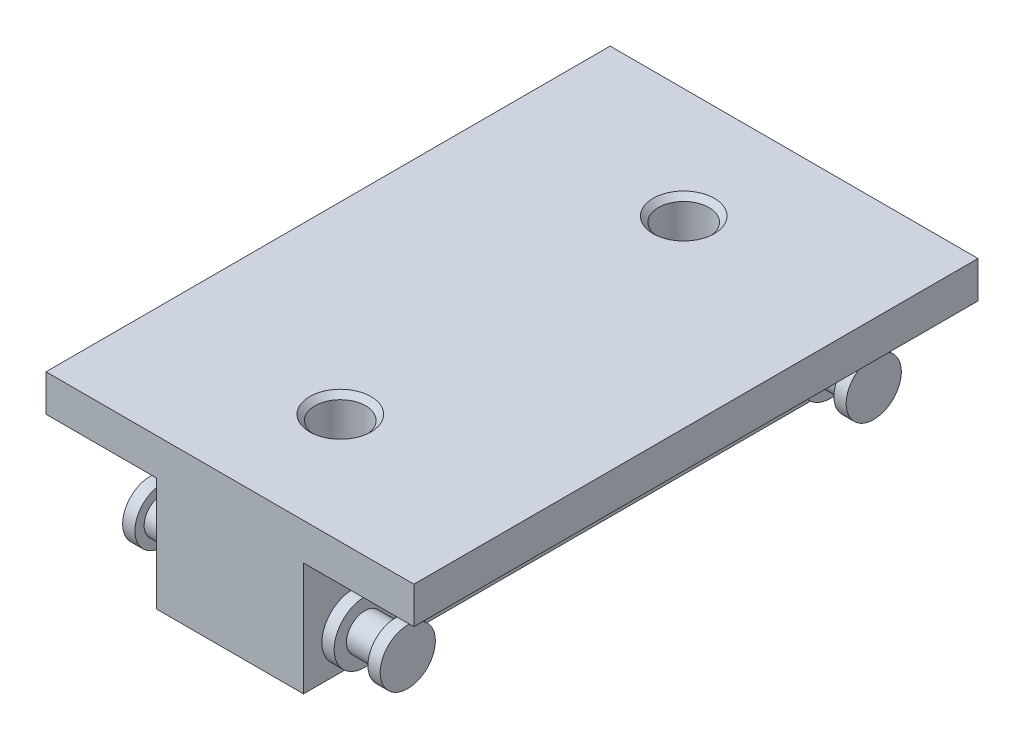
from build123d import *

# Parameters (mm, degrees)
BOSS_EXTRUDE1_DEPTH      = 23
BOSS_EXTRUDE1_DEPTH_BACK = 23


with BuildPart() as part:
    # Sketch1 → Boss-Extrude1 (new, two sides: drawn at the far end of the back side and taken through both)
    with BuildSketch(Plane.XY.offset(-BOSS_EXTRUDE1_DEPTH_BACK)):
        Polygon((-15, 6.25), (-15, 3.25), (-6, 3.25), (-6, -6), (6, -6), (6, 3.25), (15, 3.25), (15, 6.25), align=None)
    extrude(amount=BOSS_EXTRUDE1_DEPTH + BOSS_EXTRUDE1_DEPTH_BACK)

    # Sketch2 → Revolve1 (revolve)
    with BuildSketch(Plane.XY.offset(19)):
        Polygon((10.5, -3.125), (10.5, -5.375), (9.5, -5.375), (9.5, -4.625), (7, -4.625), (7, -5.625), (6, -5.625), (6, -4.625), (-6, -4.625), (-6, -5.625), (-7, -5.625), (-7, -4.625), (-9.5, -4.625), (-9.5, -5.375), (-10.5, -5.375), (-10.5, -3.125), align=None)
    revolve(axis=Axis((-10.5, -3.125, 19), (1, 0, 0)))

    # Sketch3 → Revolve2 (revolve)
    with BuildSketch(Plane.XY.offset(-19)):
        Polygon((10.5, -3.125), (10.5, -5.375), (9.5, -5.375), (9.5, -4.625), (7, -4.625), (7, -5.625), (6, -5.625), (6, -4.625), (-6, -4.625), (-6, -5.625), (-7, -5.625), (-7, -4.625), (-9.5, -4.625), (-9.5, -5.375), (-10.5, -5.375), (-10.5, -3.125), align=None)
    revolve(axis=Axis((-10.5, -3.125, -19), (1, 0, 0)))

    # Sketch4 → Cut-Revolve1 (revolve, cut)
    with BuildSketch(Plane(origin=(0, 0, 0), x_dir=(0, 0, -1), z_dir=(1, 0, 0))):
        Polygon((-14, 6.25), (-11.5, 6.25), (-11.933, 5.817), (-11.933, -5.567), (-11.5, -6), (-14, -6), align=None)
    revolve(axis=Axis((0, -6, 14), (0, 1, 0)), mode=Mode.SUBTRACT)

    # Sketch5 → Cut-Revolve2 (revolve, cut)
    with BuildSketch(Plane(origin=(0, 0, 0), x_dir=(0, 0, -1), z_dir=(1, 0, 0))):
        Polygon((14, 6.25), (16.5, 6.25), (16.067, 5.817), (16.067, -5.567), (16.5, -6), (14, -6), align=None)
    revolve(axis=Axis((0, -6, -14), (0, 1, 0)), mode=Mode.SUBTRACT)


solid = part.part
